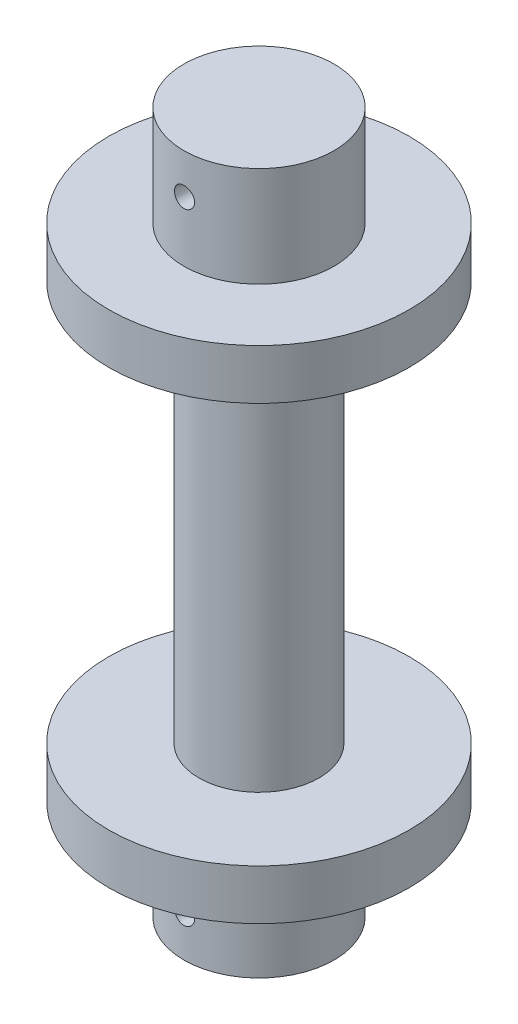
from build123d import *

# Parameters (mm, degrees)
SKETCH1_R               = 7.5
BOSS_EXTRUDE1_DEPTH     = 10
SKETCH2_R               = 15
BOSS_EXTRUDE2_DEPTH     = 5
SKETCH3_R               = 6
BOSS_EXTRUDE3_DEPTH     = 40
SKETCH4_R               = 15
BOSS_EXTRUDE4_DEPTH     = 5
SKETCH5_R               = 7.5
BOSS_EXTRUDE5_DEPTH     = 10
CUT_EXTRUDE1_DEPTH      = 74.143694192
CUT_EXTRUDE1_DEPTH_BACK = 74.143694192
SKETCH6_R               = 1


with BuildPart() as part:
    # Sketch1 → Boss-Extrude1 (new body)
    with BuildSketch(Plane(origin=(0, 0, 0), x_dir=(1, 0, 0), z_dir=(0, 1, 0))):
        with Locations(Location((0, 0, 0), (0, 0, 270))):
            Circle(SKETCH1_R)
    extrude(amount=BOSS_EXTRUDE1_DEPTH)

    # Sketch2 → Boss-Extrude2 (add)
    with BuildSketch(Plane(origin=(0, 10, 0), x_dir=(1, 0, 0), z_dir=(0, 1, 0))):
        with Locations(Location((0, 0, 0), (0, 0, 270))):
            Circle(SKETCH2_R)
    extrude(amount=BOSS_EXTRUDE2_DEPTH)

    # Sketch3 → Boss-Extrude3 (add)
    with BuildSketch(Plane(origin=(0, 15, 0), x_dir=(1, 0, 0), z_dir=(0, 1, 0))):
        with Locations(Location((0, 0, 0), (0, 0, 270))):
            Circle(SKETCH3_R)
    extrude(amount=BOSS_EXTRUDE3_DEPTH)

    # Sketch4 → Boss-Extrude4 (add)
    with BuildSketch(Plane(origin=(0, 55, 0), x_dir=(1, 0, 0), z_dir=(0, 1, 0))):
        with Locations(Location((0, 0, 0), (0, 0, 270))):
            Circle(SKETCH4_R)
    extrude(amount=BOSS_EXTRUDE4_DEPTH)

    # Sketch5 → Boss-Extrude5 (add)
    with BuildSketch(Plane(origin=(0, 60, 0), x_dir=(1, 0, 0), z_dir=(0, 1, 0))):
        with Locations(Location((0, 0, 0), (0, 0, 270))):
            Circle(SKETCH5_R)
    extrude(amount=BOSS_EXTRUDE5_DEPTH)

    # Sketch6 → Cut-Extrude1 (cut, two sides: drawn at the far end of the back side and taken through both)
    with BuildSketch(Plane.XY.offset(-CUT_EXTRUDE1_DEPTH_BACK)):
        with Locations((0, 4)):
            Circle(SKETCH6_R)
        with Locations((0, 66)):
            Circle(SKETCH6_R)
    extrude(amount=CUT_EXTRUDE1_DEPTH + CUT_EXTRUDE1_DEPTH_BACK, mode=Mode.SUBTRACT)


solid = part.part
